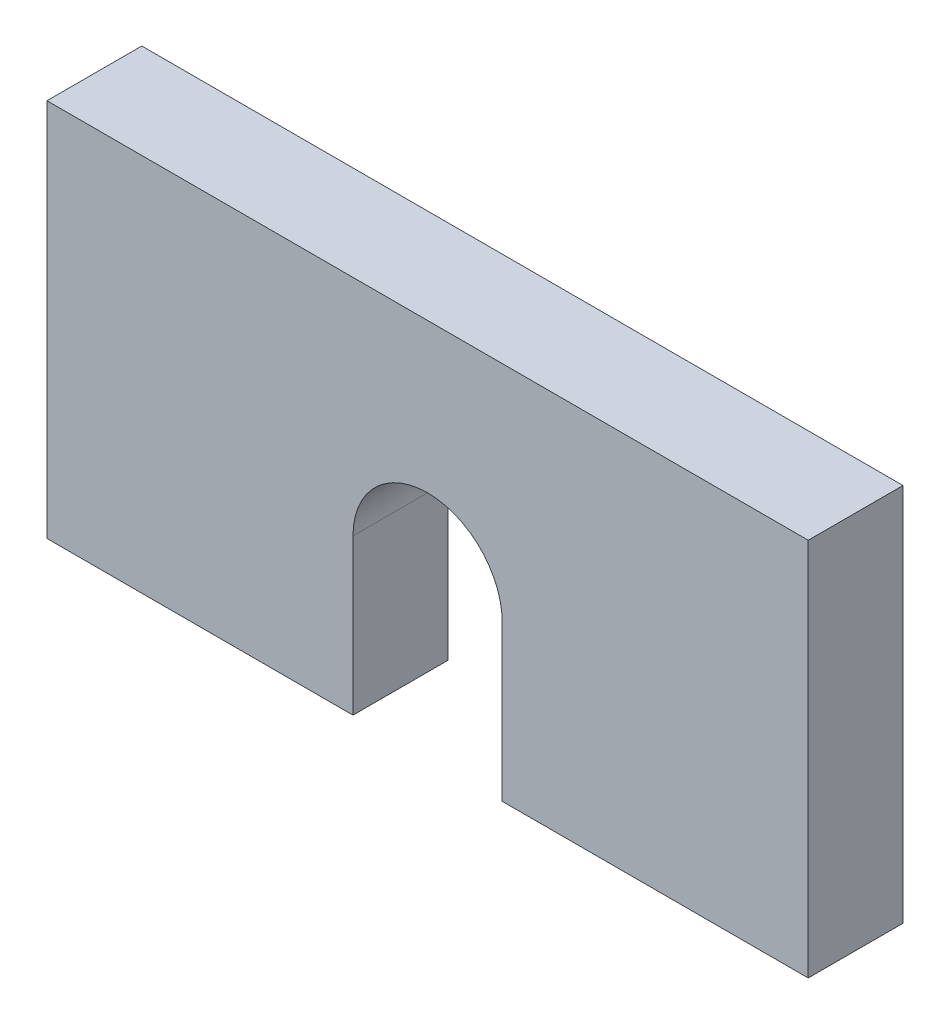
from build123d import *

# Parameters (mm, degrees)
BOSS_EXTRUDE1_DEPTH = 6.35


with BuildPart() as part:
    # Sketch1 → Boss-Extrude1 (new body)
    with BuildSketch(Plane.XY):
        with BuildLine():
            Line((-5, 0), (-5, -10.4))
            Line((-5, -10.4), (-25.5, -10.4))
            Line((-25.5, -10.4), (-25.5, 15))
            Line((-25.5, 15), (25.5, 15))
            Line((25.5, 15), (25.5, -10.4))
            Line((25.5, -10.4), (5, -10.4))
            Line((5, -10.4), (5, 0))
            ThreePointArc((5, 0), (0, 5), (-5, 0))
        make_face()
    extrude(amount=BOSS_EXTRUDE1_DEPTH)


solid = part.part
